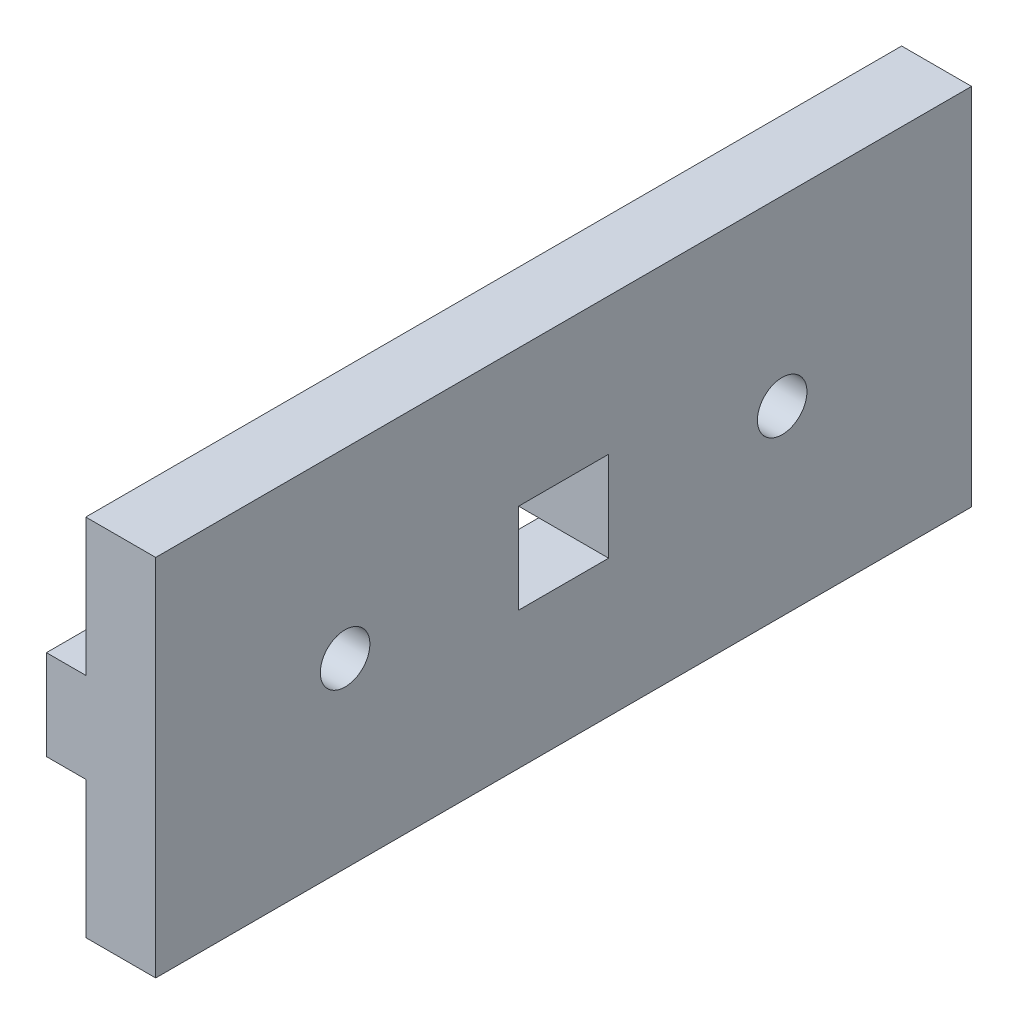
from build123d import *

# Parameters (mm, degrees)
BOSS_EXTRUDE1_DEPTH = 71.12
SKETCH2_R           = 6
CUT_EXTRUDE1_DEPTH  = 4
CUT_EXTRUDE2_REACH  = 76.031
SKETCH3_R           = 2.16
CUT_EXTRUDE3_REACH  = 76.436
SKETCH5_W           = 7.8486
SKETCH5_H           = 7.8486


with BuildPart() as part:
    # Sketch1 → Boss-Extrude1 (new body)
    with BuildSketch(Plane.XY):
        Polygon((9.127895876, 7.8486), (9.127895876, 0), (12.556895876, 0), (12.556895876, -11.9507), (18.652895876, -11.9507), (18.652895876, 19.7993), (12.556895876, 19.7993), (12.556895876, 7.8486), align=None)
    extrude(amount=BOSS_EXTRUDE1_DEPTH)

    # Sketch2 → Cut-Extrude1 (cut)
    with BuildSketch(Plane.ZY.offset(-9.127895876)):
        with Locations((16.51, 3.9243)):
            Circle(SKETCH2_R)
        with Locations((54.61, 3.9243)):
            Circle(SKETCH2_R)
    extrude(amount=-CUT_EXTRUDE1_DEPTH, mode=Mode.SUBTRACT)

    # Sketch3 → Cut-Extrude2 (cut, up to next)
    with BuildSketch(Plane.ZY.offset(-13.127895876), mode=Mode.PRIVATE) as cut_extrude2_sk1:
        with Locations((16.51, 3.9243)):
            Circle(SKETCH3_R)
    cut_extrude2_tool1 = extrude(cut_extrude2_sk1.sketch, amount=-CUT_EXTRUDE2_REACH, mode=Mode.PRIVATE) & part.part
    # Sketch3 → Cut-Extrude2 (cut, up to next)
    with BuildSketch(Plane.ZY.offset(-13.127895876), mode=Mode.PRIVATE) as cut_extrude2_sk2:
        with Locations((54.61, 3.9243)):
            Circle(SKETCH3_R)
    cut_extrude2_tool2 = extrude(cut_extrude2_sk2.sketch, amount=-CUT_EXTRUDE2_REACH, mode=Mode.PRIVATE) & part.part
    add(cut_extrude2_tool1.solids().sort_by_distance((13.127896, 3.9243, 16.51))[0], mode=Mode.SUBTRACT)
    add(cut_extrude2_tool2.solids().sort_by_distance((13.127896, 3.9243, 54.61))[0], mode=Mode.SUBTRACT)

    # Sketch5 → Cut-Extrude3 (cut, up to next)
    with BuildSketch(Plane.ZY.offset(-9.127895876), mode=Mode.PRIVATE) as cut_extrude3_sk1:
        with Locations((35.56, 3.9243)):
            Rectangle(SKETCH5_W, SKETCH5_H)
    cut_extrude3_tool1 = extrude(cut_extrude3_sk1.sketch, amount=-CUT_EXTRUDE3_REACH, mode=Mode.PRIVATE) & part.part
    add(cut_extrude3_tool1.solids().sort_by_distance((9.127896, 3.9243, 35.56))[0], mode=Mode.SUBTRACT)


solid = part.part
